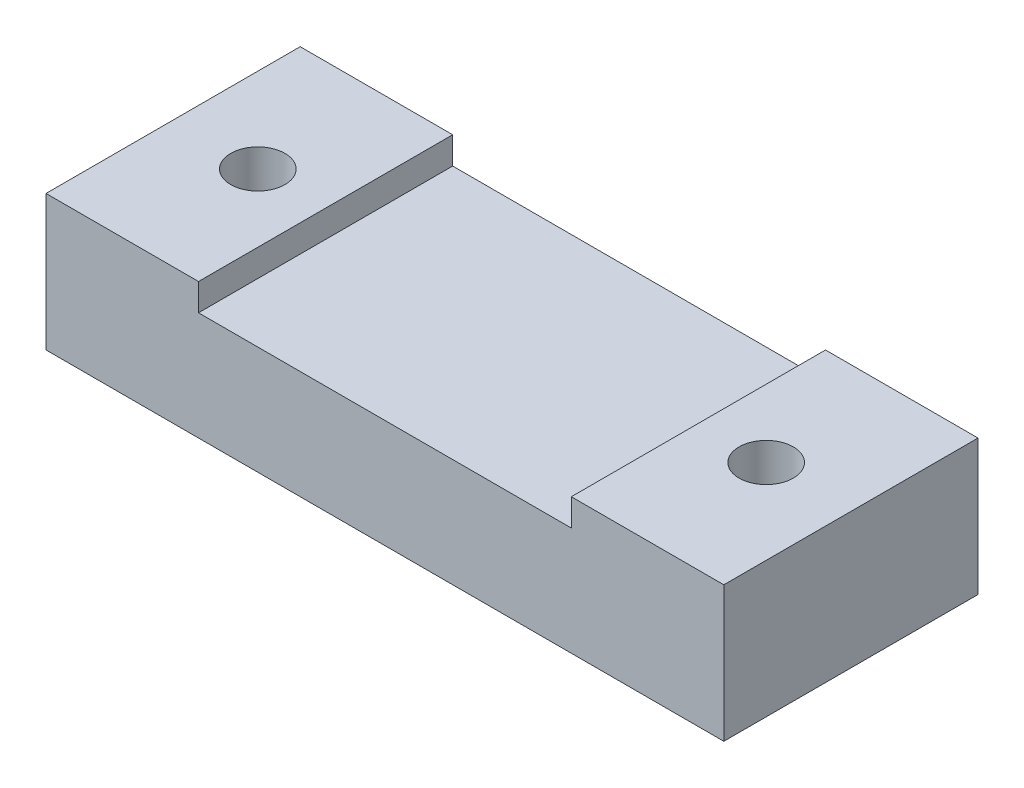
from build123d import *

# Parameters (mm, degrees)
SKETCH1_W           = 40
SKETCH1_H           = 15
BOSS_EXTRUDE1_DEPTH = 8
SKETCH2_R           = 1.6
CUT_EXTRUDE1_DEPTH  = 23.808989456
SKETCH3_W           = 22
SKETCH3_H           = 15
CUT_EXTRUDE2_DEPTH  = 1.6
CUT_EXTRUDE3_DEPTH  = 3


with BuildPart() as part:
    # Sketch1 → Boss-Extrude1 (new body)
    with BuildSketch(Plane(origin=(0, 0, 0), x_dir=(1, 0, 0), z_dir=(0, 1, 0))):
        Rectangle(SKETCH1_W, SKETCH1_H)
    extrude(amount=BOSS_EXTRUDE1_DEPTH)

    # Sketch2 → Cut-Extrude1 (cut, through all)
    with BuildSketch(Plane(origin=(0, 8, 0), x_dir=(1, 0, 0), z_dir=(0, 1, 0))):
        with Locations(Location((-15, 0, 0), (0, 0, 270))):
            Circle(SKETCH2_R)
        with Locations(Location((15, 0, 0), (0, 0, 270))):
            Circle(SKETCH2_R)
    extrude(amount=-CUT_EXTRUDE1_DEPTH, mode=Mode.SUBTRACT)

    # Sketch3 → Cut-Extrude2 (cut)
    with BuildSketch(Plane(origin=(0, 8, 0), x_dir=(1, 0, 0), z_dir=(0, 1, 0))):
        Rectangle(SKETCH3_W, SKETCH3_H)
    extrude(amount=-CUT_EXTRUDE2_DEPTH, mode=Mode.SUBTRACT)

    # Sketch4 → Cut-Extrude3 (cut)
    with BuildSketch(Plane.XZ):
        Polygon((-12, 1.732050808), (-15, 3.464101615), (-18, 1.732050808), (-18, -1.732050808), (-15, -3.464101615), (-12, -1.732050808), align=None)
        Polygon((12, -1.732050808), (12, 1.732050808), (15, 3.464101615), (18, 1.732050808), (18, -1.732050808), (15, -3.464101615), align=None)
    extrude(amount=-CUT_EXTRUDE3_DEPTH, mode=Mode.SUBTRACT)


solid = part.part
